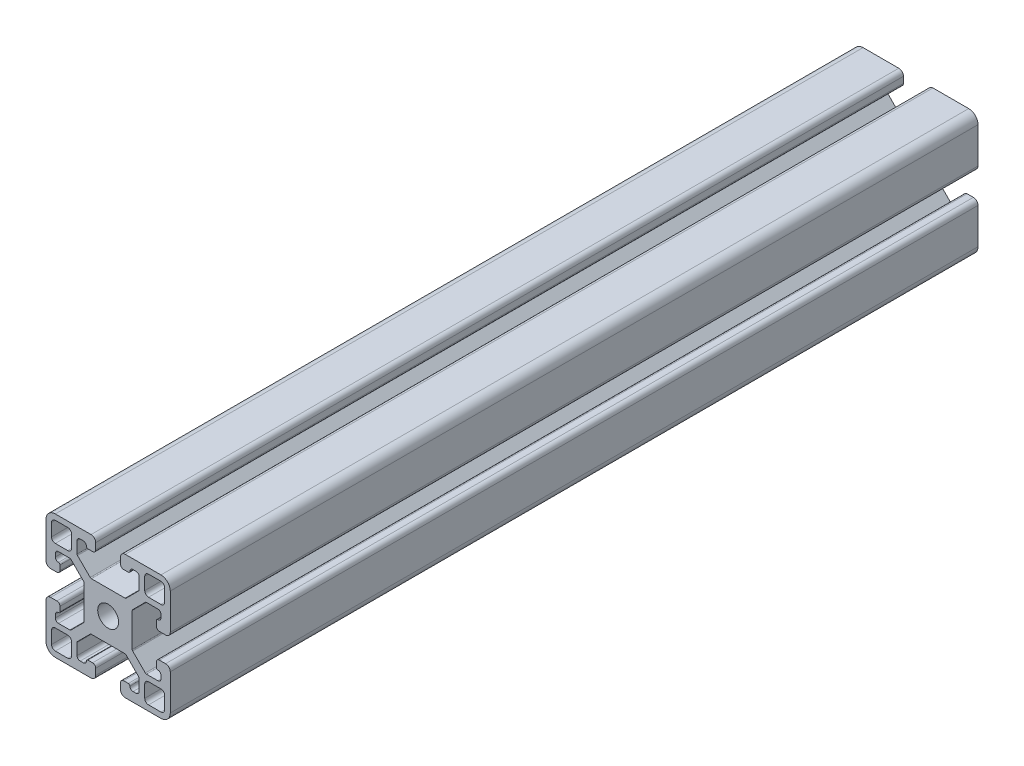
from build123d import *

# Parameters (mm, degrees)
SKETCH1_R           = 3.35
BOSS_EXTRUDE1_DEPTH = 260


with BuildPart() as part:
    # Sketch1 → Boss-Extrude1 (new body)
    with BuildSketch(Plane.XY):
        with BuildLine():
            Line((-9.853553391, -11.978553391), (-5.771446609, -7.896446609))
            ThreePointArc((-5.771446609, -7.896446609), (-5.609234935, -7.788060234), (-5.417893219, -7.75))
            Line((-5.417893219, -7.75), (5.417893219, -7.75))
            ThreePointArc((5.417893219, -7.75), (5.609234935, -7.788060234), (5.771446609, -7.896446609))
            Line((5.771446609, -7.896446609), (9.853553391, -11.978553391))
            ThreePointArc((9.853553391, -11.978553391), (9.961939766, -12.140765065), (10, -12.332106781))
            Line((10, -12.332106781), (10, -16))
            ThreePointArc((10, -16), (9.707106781, -16.707106781), (9, -17))
            Line((9, -17), (8, -17))
            ThreePointArc((8, -17), (7.292893219, -16.707106781), (7, -16))
            ThreePointArc((7, -16), (6.853553391, -15.646446609), (6.5, -15.5))
            Line((6.5, -15.5), (5, -15.5))
            ThreePointArc((5, -15.5), (4.292893219, -15.792893219), (4, -16.5))
            Line((4, -16.5), (4, -18.5))
            ThreePointArc((4, -18.5), (4.439339828, -19.560660172), (5.5, -20))
            Line((5.5, -20), (17, -20))
            ThreePointArc((17, -20), (19.121320344, -19.121320344), (20, -17))
            Line((20, -17), (20, -5.5))
            ThreePointArc((20, -5.5), (19.560660172, -4.439339828), (18.5, -4))
            Line((18.5, -4), (16.5, -4))
            ThreePointArc((16.5, -4), (15.792893219, -4.292893219), (15.5, -5))
            Line((15.5, -5), (15.5, -6.5))
            ThreePointArc((15.5, -6.5), (15.646446609, -6.853553391), (16, -7))
            ThreePointArc((16, -7), (16.707106781, -7.292893219), (17, -8))
            Line((17, -8), (17, -9))
            ThreePointArc((17, -9), (16.707106781, -9.707106781), (16, -10))
            Line((16, -10), (12.332106781, -10))
            ThreePointArc((12.332106781, -10), (12.140765065, -9.961939766), (11.978553391, -9.853553391))
            Line((11.978553391, -9.853553391), (7.896446609, -5.771446609))
            ThreePointArc((7.896446609, -5.771446609), (7.788060234, -5.609234935), (7.75, -5.417893219))
            Line((7.75, -5.417893219), (7.75, 5.417893219))
            ThreePointArc((7.75, 5.417893219), (7.788060234, 5.609234935), (7.896446609, 5.771446609))
            Line((7.896446609, 5.771446609), (11.978553391, 9.853553391))
            ThreePointArc((11.978553391, 9.853553391), (12.140765065, 9.961939766), (12.332106781, 10))
            Line((12.332106781, 10), (16, 10))
            ThreePointArc((16, 10), (16.707106781, 9.707106781), (17, 9))
            Line((17, 9), (17, 8))
            ThreePointArc((17, 8), (16.707106781, 7.292893219), (16, 7))
            ThreePointArc((16, 7), (15.646446609, 6.853553391), (15.5, 6.5))
            Line((15.5, 6.5), (15.5, 5))
            ThreePointArc((15.5, 5), (15.792893219, 4.292893219), (16.5, 4))
            Line((16.5, 4), (18.5, 4))
            ThreePointArc((18.5, 4), (19.560660172, 4.439339828), (20, 5.5))
            Line((20, 5.5), (20, 17))
            ThreePointArc((20, 17), (19.121320344, 19.121320344), (17, 20))
            Line((17, 20), (5.5, 20))
            ThreePointArc((5.5, 20), (4.439339828, 19.560660172), (4, 18.5))
            Line((4, 18.5), (4, 16.5))
            ThreePointArc((4, 16.5), (4.292893219, 15.792893219), (5, 15.5))
            Line((5, 15.5), (6.5, 15.5))
            ThreePointArc((6.5, 15.5), (6.853553391, 15.646446609), (7, 16))
            ThreePointArc((7, 16), (7.292893219, 16.707106781), (8, 17))
            Line((8, 17), (9, 17))
            ThreePointArc((9, 17), (9.707106781, 16.707106781), (10, 16))
            Line((10, 16), (10, 12.332106781))
            ThreePointArc((10, 12.332106781), (9.961939766, 12.140765065), (9.853553391, 11.978553391))
            Line((9.853553391, 11.978553391), (5.771446609, 7.896446609))
            ThreePointArc((5.771446609, 7.896446609), (5.609234935, 7.788060234), (5.417893219, 7.75))
            Line((5.417893219, 7.75), (-5.417893219, 7.75))
            ThreePointArc((-5.417893219, 7.75), (-5.609234935, 7.788060234), (-5.771446609, 7.896446609))
            Line((-5.771446609, 7.896446609), (-9.853553391, 11.978553391))
            ThreePointArc((-9.853553391, 11.978553391), (-9.961939766, 12.140765065), (-10, 12.332106781))
            Line((-10, 12.332106781), (-10, 16))
            ThreePointArc((-10, 16), (-9.707106781, 16.707106781), (-9, 17))
            Line((-9, 17), (-8, 17))
            ThreePointArc((-8, 17), (-7.292893219, 16.707106781), (-7, 16))
            ThreePointArc((-7, 16), (-6.853553391, 15.646446609), (-6.5, 15.5))
            Line((-6.5, 15.5), (-5, 15.5))
            ThreePointArc((-5, 15.5), (-4.292893219, 15.792893219), (-4, 16.5))
            Line((-4, 16.5), (-4, 18.5))
            ThreePointArc((-4, 18.5), (-4.439339828, 19.560660172), (-5.5, 20))
            Line((-5.5, 20), (-17, 20))
            ThreePointArc((-17, 20), (-19.121320344, 19.121320344), (-20, 17))
            Line((-20, 17), (-20, 5.5))
            ThreePointArc((-20, 5.5), (-19.560660172, 4.439339828), (-18.5, 4))
            Line((-18.5, 4), (-16.5, 4))
            ThreePointArc((-16.5, 4), (-15.792893219, 4.292893219), (-15.5, 5))
            Line((-15.5, 5), (-15.5, 6.5))
            ThreePointArc((-15.5, 6.5), (-15.646446609, 6.853553391), (-16, 7))
            ThreePointArc((-16, 7), (-16.707106781, 7.292893219), (-17, 8))
            Line((-17, 8), (-17, 9))
            ThreePointArc((-17, 9), (-16.707106781, 9.707106781), (-16, 10))
            Line((-16, 10), (-12.332106781, 10))
            ThreePointArc((-12.332106781, 10), (-12.140765065, 9.961939766), (-11.978553391, 9.853553391))
            Line((-11.978553391, 9.853553391), (-7.896446609, 5.771446609))
            ThreePointArc((-7.896446609, 5.771446609), (-7.788060234, 5.609234935), (-7.75, 5.417893219))
            Line((-7.75, 5.417893219), (-7.75, -5.417893219))
            ThreePointArc((-7.75, -5.417893219), (-7.788060234, -5.609234935), (-7.896446609, -5.771446609))
            Line((-7.896446609, -5.771446609), (-11.978553391, -9.853553391))
            ThreePointArc((-11.978553391, -9.853553391), (-12.140765065, -9.961939766), (-12.332106781, -10))
            Line((-12.332106781, -10), (-16, -10))
            ThreePointArc((-16, -10), (-16.707106781, -9.707106781), (-17, -9))
            Line((-17, -9), (-17, -8))
            ThreePointArc((-17, -8), (-16.707106781, -7.292893219), (-16, -7))
            ThreePointArc((-16, -7), (-15.646446609, -6.853553391), (-15.5, -6.5))
            Line((-15.5, -6.5), (-15.5, -5))
            ThreePointArc((-15.5, -5), (-15.792893219, -4.292893219), (-16.5, -4))
            Line((-16.5, -4), (-18.5, -4))
            ThreePointArc((-18.5, -4), (-19.560660172, -4.439339828), (-20, -5.5))
            Line((-20, -5.5), (-20, -17))
            ThreePointArc((-20, -17), (-19.121320344, -19.121320344), (-17, -20))
            Line((-17, -20), (-5.5, -20))
            ThreePointArc((-5.5, -20), (-4.439339828, -19.560660172), (-4, -18.5))
            Line((-4, -18.5), (-4, -16.5))
            ThreePointArc((-4, -16.5), (-4.292893219, -15.792893219), (-5, -15.5))
            Line((-5, -15.5), (-6.5, -15.5))
            ThreePointArc((-6.5, -15.5), (-6.853553391, -15.646446609), (-7, -16))
            ThreePointArc((-7, -16), (-7.292893219, -16.707106781), (-8, -17))
            Line((-8, -17), (-9, -17))
            ThreePointArc((-9, -17), (-9.707106781, -16.707106781), (-10, -16))
            Line((-10, -16), (-10, -12.332106781))
            ThreePointArc((-10, -12.332106781), (-9.961939766, -12.140765065), (-9.853553391, -11.978553391))
        make_face()
        Circle(SKETCH1_R, mode=Mode.SUBTRACT)
        with BuildLine():
            Line((-17, 11.78), (-13, 11.78))
            ThreePointArc((-13, 11.78), (-12.137329727, 12.137329727), (-11.78, 13))
            Line((-11.78, 13), (-11.78, 17))
            ThreePointArc((-11.78, 17), (-12.137329727, 17.862670273), (-13, 18.22))
            Line((-13, 18.22), (-17, 18.22))
            ThreePointArc((-17, 18.22), (-17.862670273, 17.862670273), (-18.22, 17))
            Line((-18.22, 17), (-18.22, 13))
            ThreePointArc((-18.22, 13), (-17.862670273, 12.137329727), (-17, 11.78))
        make_face(mode=Mode.SUBTRACT)
        with BuildLine():
            Line((-18.22, -13), (-18.22, -17))
            ThreePointArc((-18.22, -17), (-17.862670273, -17.862670273), (-17, -18.22))
            Line((-17, -18.22), (-13, -18.22))
            ThreePointArc((-13, -18.22), (-12.137329727, -17.862670273), (-11.78, -17))
            Line((-11.78, -17), (-11.78, -13))
            ThreePointArc((-11.78, -13), (-12.137329727, -12.137329727), (-13, -11.78))
            Line((-13, -11.78), (-17, -11.78))
            ThreePointArc((-17, -11.78), (-17.862670273, -12.137329727), (-18.22, -13))
        make_face(mode=Mode.SUBTRACT)
        with BuildLine():
            Line((13, -18.22), (17, -18.22))
            ThreePointArc((17, -18.22), (17.862670273, -17.862670273), (18.22, -17))
            Line((18.22, -17), (18.22, -13))
            ThreePointArc((18.22, -13), (17.862670273, -12.137329727), (17, -11.78))
            Line((17, -11.78), (13, -11.78))
            ThreePointArc((13, -11.78), (12.137329727, -12.137329727), (11.78, -13))
            Line((11.78, -13), (11.78, -17))
            ThreePointArc((11.78, -17), (12.137329727, -17.862670273), (13, -18.22))
        make_face(mode=Mode.SUBTRACT)
        with BuildLine():
            Line((18.22, 13), (18.22, 17))
            ThreePointArc((18.22, 17), (17.862670273, 17.862670273), (17, 18.22))
            Line((17, 18.22), (13, 18.22))
            ThreePointArc((13, 18.22), (12.137329727, 17.862670273), (11.78, 17))
            Line((11.78, 17), (11.78, 13))
            ThreePointArc((11.78, 13), (12.137329727, 12.137329727), (13, 11.78))
            Line((13, 11.78), (17, 11.78))
            ThreePointArc((17, 11.78), (17.862670273, 12.137329727), (18.22, 13))
        make_face(mode=Mode.SUBTRACT)
    extrude(amount=BOSS_EXTRUDE1_DEPTH)


solid = part.part
